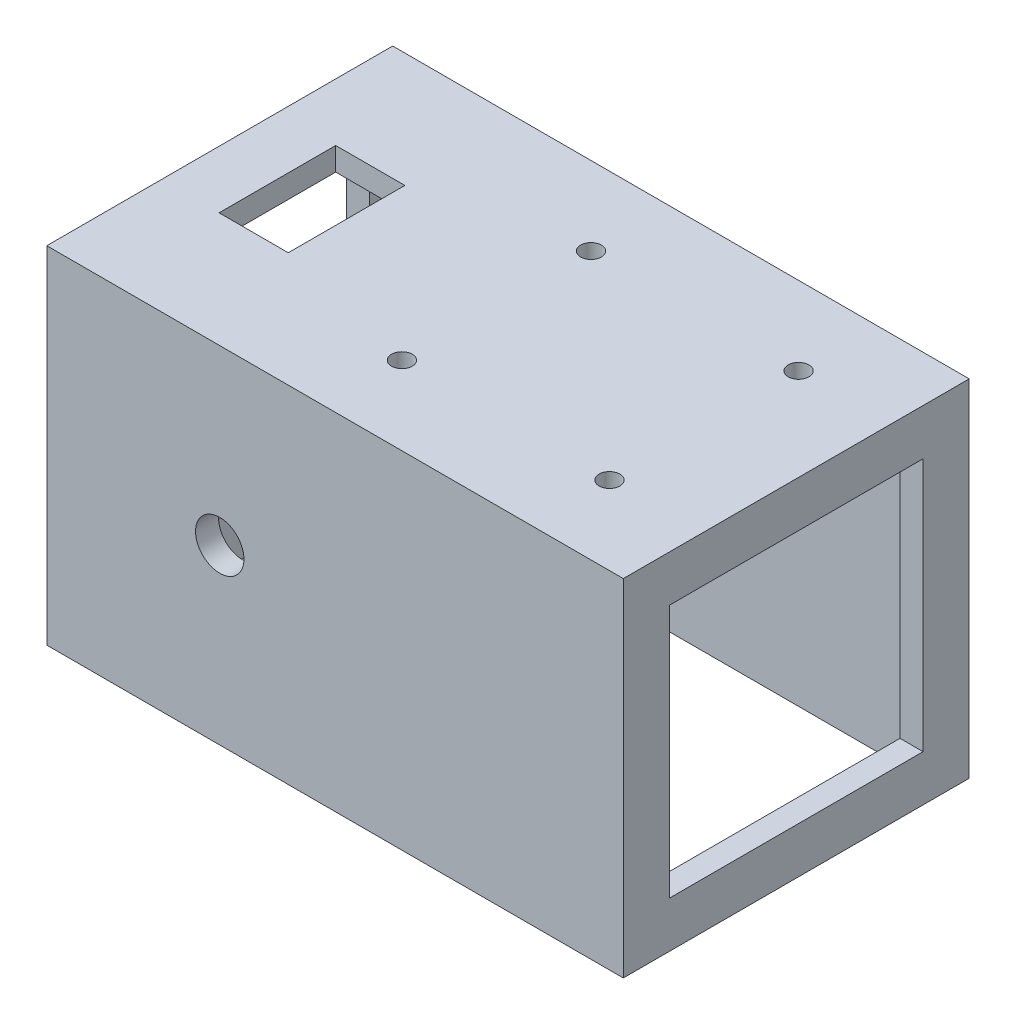
from build123d import *

# Parameters (mm, degrees)
SKETCH1_W           = 63.5
SKETCH1_H           = 38.1
BOSS_EXTRUDE1_DEPTH = 19.05
SHELL1_T            = -2.54
SKETCH2_R           = 1.143
CUT_EXTRUDE1_DEPTH  = 54.127911685
SKETCH4_W           = 7.62
SKETCH4_H           = 12.842115784
CUT_EXTRUDE2_DEPTH  = 54.127911685
SKETCH5_R           = 2.667
CUT_EXTRUDE3_DEPTH  = 54.127911685
SKETCH6_W           = 27.94
SKETCH6_H           = 27.94
CUT_EXTRUDE4_DEPTH  = 69.978656119


with BuildPart() as part:
    # Sketch1 → Boss-Extrude1 (new, symmetric)
    with BuildSketch(Plane.XY):
        Rectangle(SKETCH1_W, SKETCH1_H)
    extrude(amount=BOSS_EXTRUDE1_DEPTH, both=True)

    # Shell1
    shell1_openings = [part.faces().sort_by_distance(p)[0] for p in [
        (0, -19.05, 0),
    ]]
    offset(amount=SHELL1_T, openings=shell1_openings, kind=Kind.INTERSECTION)

    # Sketch2 → Cut-Extrude1 (cut, through all)
    with BuildSketch(Plane(origin=(0, 19.05, 0), x_dir=(1, 0, 0), z_dir=(0, 1, 0))):
        with Locations(Location((-1.27, 10.414, 0), (0, 0, 270))):
            Circle(SKETCH2_R)
        with Locations(Location((21.59, 10.414, 0), (0, 0, 270))):
            Circle(SKETCH2_R)
        with Locations(Location((21.59, -10.414, 0), (0, 0, 270))):
            Circle(SKETCH2_R)
        with Locations(Location((-1.27, -10.414, 0), (0, 0, 270))):
            Circle(SKETCH2_R)
    extrude(amount=-CUT_EXTRUDE1_DEPTH, mode=Mode.SUBTRACT)

    # Sketch4 → Cut-Extrude2 (cut, through all)
    with BuildSketch(Plane(origin=(0, 19.05, 0), x_dir=(1, 0, 0), z_dir=(0, 1, 0))):
        with Locations((-21.59, 0)):
            Rectangle(SKETCH4_W, SKETCH4_H)
    extrude(amount=-CUT_EXTRUDE2_DEPTH, mode=Mode.SUBTRACT)

    # Sketch5 → Cut-Extrude3 (cut, through all)
    with BuildSketch(Plane.XY.offset(19.05)):
        with Locations((-12.7, 0)):
            Circle(SKETCH5_R)
    extrude(amount=-CUT_EXTRUDE3_DEPTH, mode=Mode.SUBTRACT)

    # Sketch6 → Cut-Extrude4 (cut, through all)
    with BuildSketch(Plane.ZY.offset(31.75)):
        Rectangle(SKETCH6_W, SKETCH6_H)
    extrude(amount=-CUT_EXTRUDE4_DEPTH, mode=Mode.SUBTRACT)


solid = part.part
